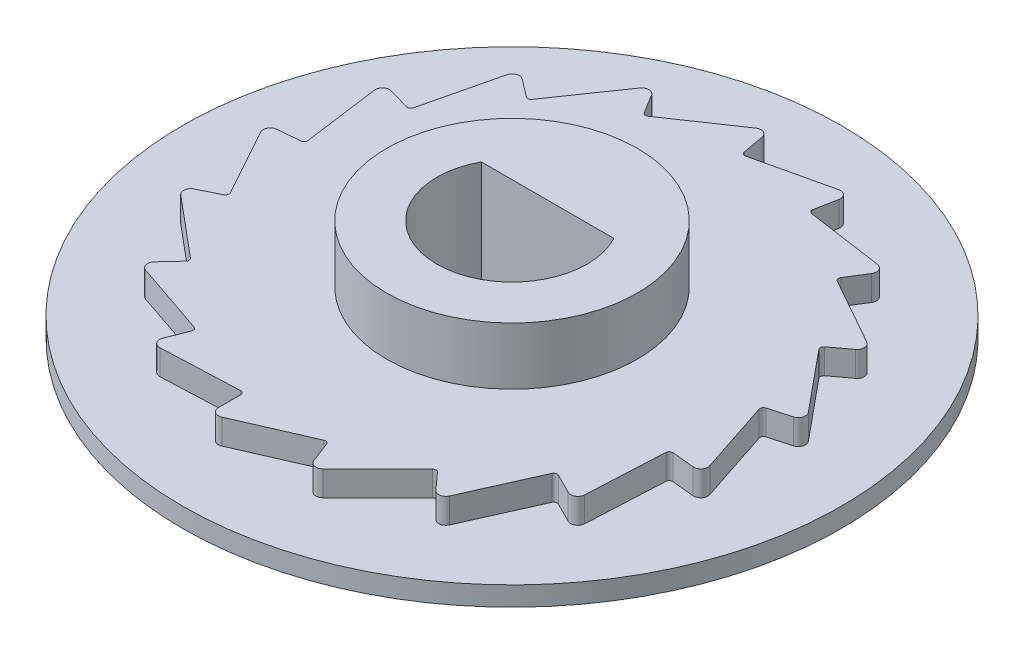
from build123d import *

# Parameters (mm, degrees)
SKETCH1_R           = 58.42
BOSS_EXTRUDE1_DEPTH = 3.429
SKETCH2_R           = 47.700633093
BOSS_EXTRUDE3_DEPTH = 4.445
CUT_EXTRUDE2_START  = -4.445
CUT_EXTRUDE2_DEPTH  = 4.445
CIRPATTERN1_COUNT   = 17
FILLET1_R           = 1.27
FILLET2_R           = 0.635
SKETCH5_R           = 22.225
BOSS_EXTRUDE4_DEPTH = 10.16
CUT_EXTRUDE3_DEPTH  = 85.563691712
SKETCH7_R           = 20.32
SKETCH7_R_2         = 19.05
CUT_EXTRUDE4_DEPTH  = 10.16


with BuildPart() as part:
    # Sketch1 → Boss-Extrude1 (new body)
    with BuildSketch(Plane(origin=(0, 0, 0), x_dir=(1, 0, 0), z_dir=(0, 1, 0))):
        with Locations(Location((0, 0, 0), (0, 0, 270))):
            Circle(SKETCH1_R)
    extrude(amount=BOSS_EXTRUDE1_DEPTH)

    # Sketch2 → Boss-Extrude3 (add)
    with BuildSketch(Plane(origin=(0, 3.429, 0), x_dir=(1, 0, 0), z_dir=(0, 1, 0))):
        with Locations(Location((0, 0, 0), (0, 0, 270))):
            Circle(SKETCH2_R)
    extrude(amount=BOSS_EXTRUDE3_DEPTH)

    # Sketch4 → Cut-Extrude2 (cut)
    with BuildSketch(Plane(origin=(0, 7.874, 0), x_dir=(1, 0, 0), z_dir=(0, 1, 0)).offset(CUT_EXTRUDE2_START)):
        with BuildLine():
            Line((-1.27, 47.683723612), (0, 40.64))
            Line((0, 40.64), (17.007917051, 44.565470435))
            ThreePointArc((17.007917051, 44.565470435), (8.021931438, 47.021261292), (-1.27, 47.683723612))
        make_face()
    cut_extrude2 = extrude(amount=CUT_EXTRUDE2_DEPTH, mode=Mode.SUBTRACT)

    # CirPattern1: Cut-Extrude2 ×17 about axis
    cirpattern1_axis = Axis((0, 0, 0), (0, 1, 0))
    for i in range(1, CIRPATTERN1_COUNT):
        add(cut_extrude2.rotate(cirpattern1_axis, i * 360 / CIRPATTERN1_COUNT), mode=Mode.SUBTRACT)

    # Fillet1
    fillet1_edges = [part.edges().sort_by_distance(p)[0] for p in [
        (-1.160233877, 5.6515, -47.07493445),
        (15.923541887, 5.6515, -44.315193895),
        (-18.087313626, 5.6515, -43.476944257),
        (-32.571601445, 5.6515, -34.007151828),
        (-42.656914003, 5.6515, -19.944505104),
        (-46.981173955, 5.6515, -3.18824245),
        (-44.960366033, 5.6515, 13.998610014),
        (-36.867411544, 5.6515, 29.294872626),
        (-23.795308837, 5.6515, 40.634700362),
        (-7.509517816, 5.6515, 46.486586649),
        (9.790475196, 5.6515, 46.060201819),
        (25.768210283, 5.6515, 39.413131504),
        (38.265805785, 5.6515, 27.443099384),
        (45.595392177, 5.6515, 11.766724625),
        (46.767068202, 5.6515, -5.498811497),
        (41.622592522, 5.6515, -22.021702656),
        (30.856755083, 5.6515, -35.570440844),
    ]]
    fillet(fillet1_edges, radius=FILLET1_R)

    # Fillet2
    fillet2_edges = [part.edges().sort_by_distance(p)[0] for p in [
        (0, 5.6515, -40.64),
        (14.680861314, 5.6515, -37.895671403),
        (-14.680861314, 5.6515, -37.895671403),
        (-27.378990958, 5.6515, -30.033322396),
        (-36.379436161, 5.6515, -18.114806779),
        (-40.466636925, 5.6515, -3.749786129),
        (-39.088594139, 5.6515, 11.121663917),
        (-32.431420117, 5.6515, 24.491071622),
        (-21.394203099, 5.6515, 34.552824396),
        (-7.467580404, 5.6515, 39.948026771),
        (7.467580404, 5.6515, 39.948026771),
        (21.394203099, 5.6515, 34.552824396),
        (32.431420117, 5.6515, 24.491071622),
        (39.088594139, 5.6515, 11.121663917),
        (40.466636925, 5.6515, -3.749786129),
        (36.379436161, 5.6515, -18.114806779),
        (27.378990958, 5.6515, -30.033322396),
    ]]
    fillet(fillet2_edges, radius=FILLET2_R)

    # Sketch5 → Boss-Extrude4 (add)
    with BuildSketch(Plane(origin=(0, 7.874, 0), x_dir=(1, 0, 0), z_dir=(0, 1, 0))):
        with Locations(Location((0, 0, 0), (0, 0, 270))):
            Circle(SKETCH5_R)
    extrude(amount=BOSS_EXTRUDE4_DEPTH)

    # Sketch6 → Cut-Extrude3 (cut, through all)
    with BuildSketch(Plane(origin=(0, 18.034, 0), x_dir=(1, 0, 0), z_dir=(0, 1, 0))):
        with BuildLine():
            Line((-11.7475, 6.310187695), (11.7475, 6.310187695))
            ThreePointArc((11.7475, 6.310187695), (0, -13.335), (-11.7475, 6.310187695))
        make_face()
    extrude(amount=-CUT_EXTRUDE3_DEPTH, mode=Mode.SUBTRACT)

    # Sketch7 → Cut-Extrude4 (cut)
    with BuildSketch(Plane.XZ):
        with Locations(Location((0, 0, 0), (0, 0, 270))):
            Circle(SKETCH7_R)
        with Locations(Location((0, 0, 0), (0, 0, 270))):
            Circle(SKETCH7_R_2, mode=Mode.SUBTRACT)
    extrude(amount=-CUT_EXTRUDE4_DEPTH, mode=Mode.SUBTRACT)


solid = part.part
